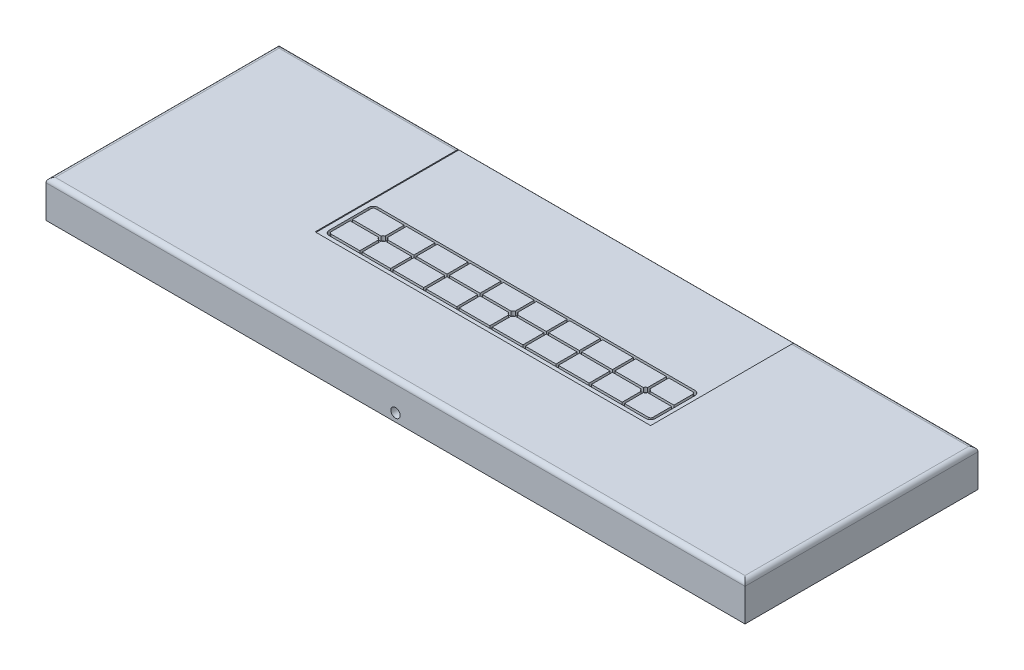
from build123d import *

# Parameters (mm, degrees)
SKETCH1_W               = 1500
SKETCH1_H               = 500
BOSS_EXTRUDE1_DEPTH     = 80
FILLET2_R               = 10
CUT_EXTRUDE2_START      = 80
SKETCH7_W               = 720
SKETCH7_H               = 439.016917436
CUT_EXTRUDE2_DEPTH      = 2
CUT_EXTRUDE1_START      = 78
SKETCH5_W               = 66
SKETCH5_H               = 45
CUT_EXTRUDE1_DEPTH      = 10
CUT_EXTRUDE3_START      = 80
SKETCH8_R               = 5
CUT_EXTRUDE3_DEPTH      = 875.606821013
CUT_EXTRUDE4_DEPTH      = 100
CUT_EXTRUDE4_DEPTH_BACK = 100
SKETCH9_W               = 720
SKETCH9_H               = 40
SKETCH11_R              = 10
CUT_EXTRUDE5_DEPTH      = 250


with BuildPart() as part:
    # Sketch1 → Boss-Extrude1 (new body)
    with BuildSketch(Plane(origin=(0, 0, 0), x_dir=(1, 0, 0), z_dir=(0, 1, 0))):
        Rectangle(SKETCH1_W, SKETCH1_H)
    extrude(amount=BOSS_EXTRUDE1_DEPTH)

    # Fillet2
    fillet2_edges = [part.edges().sort_by_distance(p)[0] for p in [
        (-750, 80, 0),
        (0, 80, 250),
        (750, 80, 0),
        (0, 80, -250),
    ]]
    fillet(fillet2_edges, radius=FILLET2_R)

    # Sketch7 → Cut-Extrude2 (cut)
    with BuildSketch(Plane(origin=(0, 0, 0), x_dir=(1, 0, 0), z_dir=(0, 1, 0)).offset(CUT_EXTRUDE2_START)):
        with Locations((0, 157.008458718)):
            Rectangle(SKETCH7_W, SKETCH7_H)
    extrude(amount=-CUT_EXTRUDE2_DEPTH, mode=Mode.SUBTRACT)

    # Sketch5 → Cut-Extrude1 (cut)
    with BuildSketch(Plane(origin=(0, 0, 0), x_dir=(1, 0, 0), z_dir=(0, 1, 0)).offset(CUT_EXTRUDE1_START)):
        with BuildLine():
            Line((-340, 52.5), (340, 52.5))
            ThreePointArc((340, 52.5), (347.071067812, 49.571067812), (350, 42.5))
            Line((350, 42.5), (350, -42.5))
            ThreePointArc((350, -42.5), (347.071067812, -49.571067812), (340, -52.5))
            Line((340, -52.5), (-340, -52.5))
            ThreePointArc((-340, -52.5), (-347.071067812, -49.571067812), (-350, -42.5))
            Line((-350, -42.5), (-350, 42.5))
            ThreePointArc((-350, 42.5), (-347.071067812, 49.571067812), (-340, 52.5))
        make_face()
        with BuildLine():
            Line((-340, 47.5), (-279, 47.5))
            Line((-279, 47.5), (-279, 7.071067812))
            ThreePointArc((-279, 7.071067812), (-281.803300859, 5.303300859), (-283.571067812, 2.5))
            Line((-283.571067812, 2.5), (-345, 2.5))
            Line((-345, 2.5), (-345, 42.5))
            ThreePointArc((-345, 42.5), (-343.535533906, 46.035533906), (-340, 47.5))
        make_face(mode=Mode.SUBTRACT)
        with BuildLine():
            Line((-340, -47.5), (-279, -47.5))
            Line((-279, -47.5), (-279, -7.071067812))
            ThreePointArc((-279, -7.071067812), (-281.803300859, -5.303300859), (-283.571067812, -2.5))
            Line((-283.571067812, -2.5), (-345, -2.5))
            Line((-345, -2.5), (-345, -42.5))
            ThreePointArc((-345, -42.5), (-343.535533906, -46.035533906), (-340, -47.5))
        make_face(mode=Mode.SUBTRACT)
        with BuildLine():
            Line((345, 42.5), (345, 2.5))
            Line((345, 2.5), (293.571067812, 2.5))
            ThreePointArc((293.571067812, 2.5), (291.803300859, 5.303300859), (289, 7.071067812))
            Line((289, 7.071067812), (289, 47.5))
            Line((289, 47.5), (340, 47.5))
            ThreePointArc((340, 47.5), (343.535533906, 46.035533906), (345, 42.5))
        make_face(mode=Mode.SUBTRACT)
        with Locations((-175, -25)):
            Rectangle(SKETCH5_W, SKETCH5_H, mode=Mode.SUBTRACT)
        with BuildLine():
            Line((0, 47.5), (0, 7.071067812))
            ThreePointArc((0, 7.071067812), (-2.803300859, 5.303300859), (-4.571067812, 2.5))
            Line((-4.571067812, 2.5), (-66, 2.5))
            Line((-66, 2.5), (-66, 47.5))
            Line((-66, 47.5), (0, 47.5))
        make_face(mode=Mode.SUBTRACT)
        with BuildLine():
            Line((5, 47.5), (5, 7.071067812))
            ThreePointArc((5, 7.071067812), (7.803300859, 5.303300859), (9.571067812, 2.5))
            Line((9.571067812, 2.5), (71, 2.5))
            Line((71, 2.5), (71, 47.5))
            Line((71, 47.5), (5, 47.5))
        make_face(mode=Mode.SUBTRACT)
        with Locations((-104, 25)):
            Rectangle(SKETCH5_W, SKETCH5_H, mode=Mode.SUBTRACT)
        with Locations((109, 25)):
            Rectangle(SKETCH5_W, SKETCH5_H, mode=Mode.SUBTRACT)
        with Locations((180, 25)):
            Rectangle(SKETCH5_W, SKETCH5_H, mode=Mode.SUBTRACT)
        with BuildLine():
            Line((218, 47.5), (218, 2.5))
            Line((218, 2.5), (279.428932188, 2.5))
            ThreePointArc((279.428932188, 2.5), (281.196699141, 5.303300859), (284, 7.071067812))
            Line((284, 7.071067812), (284, 47.5))
            Line((284, 47.5), (218, 47.5))
        make_face(mode=Mode.SUBTRACT)
        with Locations((-175, 25)):
            Rectangle(SKETCH5_W, SKETCH5_H, mode=Mode.SUBTRACT)
        with BuildLine():
            Line((-213, 47.5), (-213, 2.5))
            Line((-213, 2.5), (-269.428932188, 2.5))
            ThreePointArc((-269.428932188, 2.5), (-271.196699141, 5.303300859), (-274, 7.071067812))
            Line((-274, 7.071067812), (-274, 47.5))
            Line((-274, 47.5), (-213, 47.5))
        make_face(mode=Mode.SUBTRACT)
        with BuildLine():
            Line((-274, -7.071067812), (-274, -47.5))
            Line((-274, -47.5), (-213, -47.5))
            Line((-213, -47.5), (-213, -2.5))
            Line((-213, -2.5), (-269.428932188, -2.5))
            ThreePointArc((-269.428932188, -2.5), (-271.196699141, -5.303300859), (-274, -7.071067812))
        make_face(mode=Mode.SUBTRACT)
        with Locations((-104, -25)):
            Rectangle(SKETCH5_W, SKETCH5_H, mode=Mode.SUBTRACT)
        with BuildLine():
            Line((-66, -2.5), (-4.571067812, -2.5))
            ThreePointArc((-4.571067812, -2.5), (-2.803300859, -5.303300859), (0, -7.071067812))
            Line((0, -7.071067812), (0, -47.5))
            Line((0, -47.5), (-66, -47.5))
            Line((-66, -47.5), (-66, -2.5))
        make_face(mode=Mode.SUBTRACT)
        with BuildLine():
            Line((5, -7.071067812), (5, -47.5))
            Line((5, -47.5), (71, -47.5))
            Line((71, -47.5), (71, -2.5))
            Line((71, -2.5), (9.571067812, -2.5))
            ThreePointArc((9.571067812, -2.5), (7.803300859, -5.303300859), (5, -7.071067812))
        make_face(mode=Mode.SUBTRACT)
        with Locations((109, -25)):
            Rectangle(SKETCH5_W, SKETCH5_H, mode=Mode.SUBTRACT)
        with Locations((180, -25)):
            Rectangle(SKETCH5_W, SKETCH5_H, mode=Mode.SUBTRACT)
        with BuildLine():
            Line((218, -2.5), (218, -47.5))
            Line((218, -47.5), (284, -47.5))
            Line((284, -47.5), (284, -7.071067812))
            ThreePointArc((284, -7.071067812), (281.196699141, -5.303300859), (279.428932188, -2.5))
            Line((279.428932188, -2.5), (218, -2.5))
        make_face(mode=Mode.SUBTRACT)
        with BuildLine():
            Line((289, -7.071067812), (289, -47.5))
            Line((289, -47.5), (340, -47.5))
            ThreePointArc((340, -47.5), (343.535533906, -46.035533906), (345, -42.5))
            Line((345, -42.5), (345, -2.5))
            Line((345, -2.5), (293.571067812, -2.5))
            ThreePointArc((293.571067812, -2.5), (291.803300859, -5.303300859), (289, -7.071067812))
        make_face(mode=Mode.SUBTRACT)
    extrude(amount=-CUT_EXTRUDE1_DEPTH, mode=Mode.SUBTRACT)

    # Sketch8 → Cut-Extrude3 (cut, through all)
    with BuildSketch(Plane(origin=(0, 0, 0), x_dir=(1, 0, 0), z_dir=(0, 1, 0)).offset(CUT_EXTRUDE3_START)):
        with Locations(Location((-276.5, 0, 0), (0, 0, 270))):
            Circle(SKETCH8_R)
        with Locations(Location((2.5, 0, 0), (0, 0, 270))):
            Circle(SKETCH8_R)
        with Locations(Location((286.5, 0, 0), (0, 0, 270))):
            Circle(SKETCH8_R)
    extrude(amount=-CUT_EXTRUDE3_DEPTH, mode=Mode.SUBTRACT)

    # Sketch9 → Cut-Extrude4 (cut, two sides: drawn at the far end of the back side and taken through both)
    with BuildSketch(Plane.XY.offset(-CUT_EXTRUDE4_DEPTH_BACK)):
        with Locations((0, 20)):
            Rectangle(SKETCH9_W, SKETCH9_H)
    extrude(amount=CUT_EXTRUDE4_DEPTH + CUT_EXTRUDE4_DEPTH_BACK, mode=Mode.SUBTRACT)

    # Sketch11 → Cut-Extrude5 (cut)
    with BuildSketch(Plane.XY):
        with Locations(Location((0, 17.5, 0), (0, 0, 180))):
            Circle(SKETCH11_R)
    extrude(amount=CUT_EXTRUDE5_DEPTH, mode=Mode.SUBTRACT)


solid = part.part
